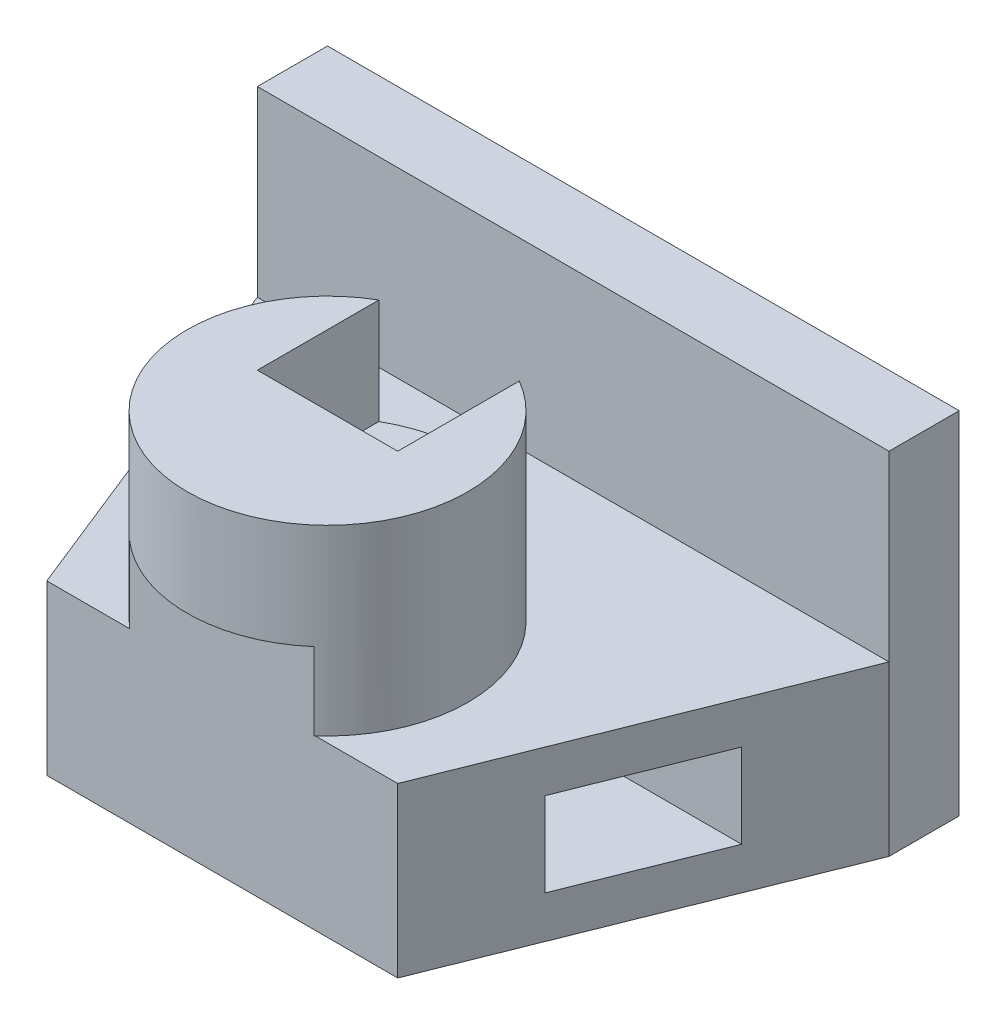
from build123d import *

# Parameters (mm, degrees)
SKETCH3_W           = 90
SKETCH3_H           = 50
BOSS_EXTRUDE1_DEPTH = 10
BOSS_EXTRUDE2_DEPTH = 24
SKETCH5_R           = 20
BOSS_EXTRUDE3_DEPTH = 26
SKETCH6_W           = 20
SKETCH6_H           = 27.110350909
CUT_EXTRUDE1_DEPTH  = 15
SKETCH7_W           = 26.369202788
SKETCH7_H           = 10.718734527
CUT_EXTRUDE2_DEPTH  = 35
SKETCH9_W           = 20
SKETCH9_H           = 12
CUT_EXTRUDE3_DEPTH  = 114.798066767


with BuildPart() as part:
    # Sketch3 → Boss-Extrude1 (new body)
    with BuildSketch(Plane.XY):
        Rectangle(SKETCH3_W, SKETCH3_H)
    extrude(amount=BOSS_EXTRUDE1_DEPTH)

    # Sketch4 → Boss-Extrude2 (add)
    with BuildSketch(Plane.XZ.offset(25)):
        Polygon((45, 10), (-45, 10), (-25, 60), (25, 60), align=None)
    extrude(amount=-BOSS_EXTRUDE2_DEPTH)

    # Sketch5 → Boss-Extrude3 (add)
    with BuildSketch(Plane(origin=(0, -1, 0), x_dir=(1, 0, 0), z_dir=(0, 1, 0))):
        with Locations(Location((0, -45, 0), (0, 0, 311.409622109))):
            Circle(SKETCH5_R)
    extrude(amount=BOSS_EXTRUDE3_DEPTH)

    # Sketch6 → Cut-Extrude1 (cut)
    with BuildSketch(Plane(origin=(0, 25, 0), x_dir=(1, 0, 0), z_dir=(0, 1, 0))):
        with Locations((0, -31.444824546)):
            Rectangle(SKETCH6_W, SKETCH6_H)
    extrude(amount=-CUT_EXTRUDE1_DEPTH, mode=Mode.SUBTRACT)

    # Sketch7 → Cut-Extrude2 (cut)
    with BuildSketch(Plane.XZ.offset(25)):
        with Locations((-0.044155161, 65.359367264)):
            Rectangle(SKETCH7_W, SKETCH7_H)
    extrude(amount=-CUT_EXTRUDE2_DEPTH, mode=Mode.SUBTRACT)

    # Sketch9 → Cut-Extrude3 (cut, through all)
    with BuildSketch(Plane(origin=(45, 0, 0), x_dir=(0, 0, -1), z_dir=(1, 0, 0))):
        with Locations((-35, -13)):
            Rectangle(SKETCH9_W, SKETCH9_H)
    extrude(amount=-CUT_EXTRUDE3_DEPTH, mode=Mode.SUBTRACT)


solid = part.part
